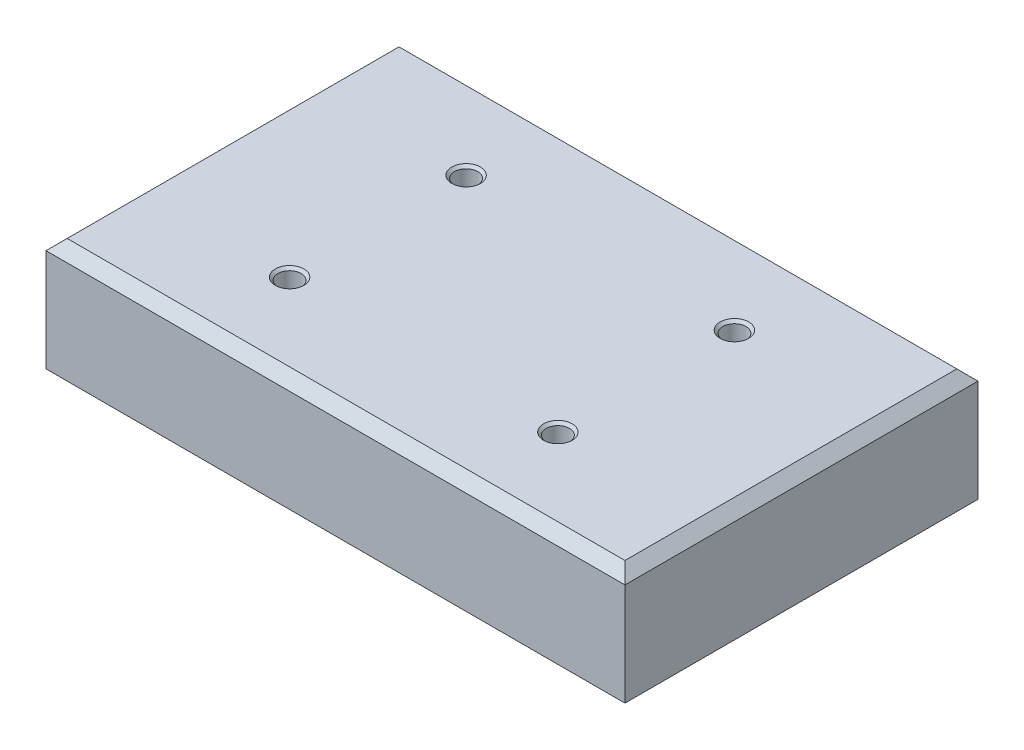
from build123d import *

# Parameters (mm, degrees)
SKETCH1_W                   = 82
SKETCH1_H                   = 50
BOSS_EXTRUDE1_DEPTH         = 16
M4_TAPPED_HOLE1_D           = 3.3
M4_TAPPED_HOLE1_DEPTH       = 8
M4_TAPPED_HOLE1_CSINK_D     = 4.05
M4_TAPPED_HOLE1_CSINK_ANGLE = 90
M4_TAPPED_HOLE1_TIP         = 0.991420021
CHAMFER1_SIZE               = 1.5


with BuildPart() as part:
    # Sketch1 → Boss-Extrude1 (new body)
    with BuildSketch(Plane(origin=(0, 0, 0), x_dir=(1, 0, 0), z_dir=(0, 1, 0))):
        Rectangle(SKETCH1_W, SKETCH1_H)
    extrude(amount=BOSS_EXTRUDE1_DEPTH)

    # M4 Tapped Hole1
    with Locations(Plane(origin=(0, 16, 0), x_dir=(1, 0, 0), z_dir=(0, 1, 0))):
        with Locations((-19, 12.5), (-19, -12.5), (19, -12.5), (19, 12.5)):
            CounterSinkHole(M4_TAPPED_HOLE1_D / 2, M4_TAPPED_HOLE1_CSINK_D / 2, depth=M4_TAPPED_HOLE1_DEPTH, counter_sink_angle=M4_TAPPED_HOLE1_CSINK_ANGLE)
            with Locations((0, 0, -(M4_TAPPED_HOLE1_DEPTH + M4_TAPPED_HOLE1_TIP / 2))):  # 118° drill point
                Cone(0, M4_TAPPED_HOLE1_D / 2, M4_TAPPED_HOLE1_TIP, mode=Mode.SUBTRACT)

    # Chamfer1
    chamfer1_edges = [part.edges().sort_by_distance(p)[0] for p in [
        (-41, 16, 0),
        (0, 16, 25),
        (41, 16, 0),
        (0, 16, -25),
    ]]
    chamfer(chamfer1_edges, length=CHAMFER1_SIZE)


solid = part.part
